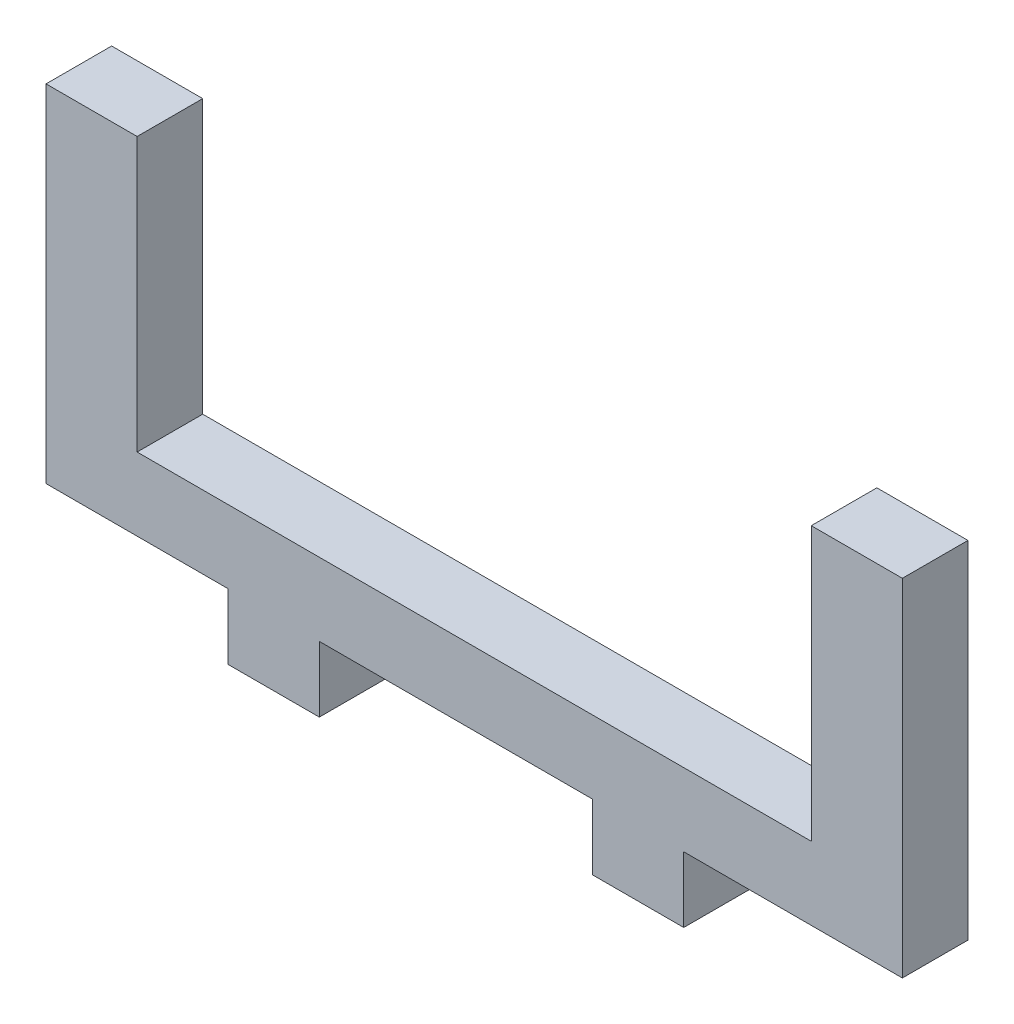
from build123d import *

# Parameters (mm, degrees)
SKETCH1_W           = 6.35
SKETCH1_H           = 19.05
SKETCH1_H_2         = 4.572
BOSS_EXTRUDE1_DEPTH = 4.572


with BuildPart() as part:
    # Sketch1 → Boss-Extrude1 (new body)
    with BuildSketch(Plane.XY):
        Polygon((19.05, -5.08), (29.845, -5.08), (29.845, 0), (6.35, 0), (0, 0), (0, -5.08), (12.7, -5.08), align=None)
        with Locations((3.175, 9.525)):
            Rectangle(SKETCH1_W, SKETCH1_H)
        with Locations((15.875, -7.366)):
            Rectangle(SKETCH1_W, SKETCH1_H_2)
        Polygon((29.845, 0), (29.845, -5.08), (38.1, -5.08), (44.45, -5.08), (59.69, -5.08), (59.69, 0), (53.34, 0), align=None)
        with Locations((56.515, 9.525)):
            Rectangle(SKETCH1_W, SKETCH1_H)
        with Locations((41.275, -7.366)):
            Rectangle(SKETCH1_W, SKETCH1_H_2)
    extrude(amount=BOSS_EXTRUDE1_DEPTH)


solid = part.part
